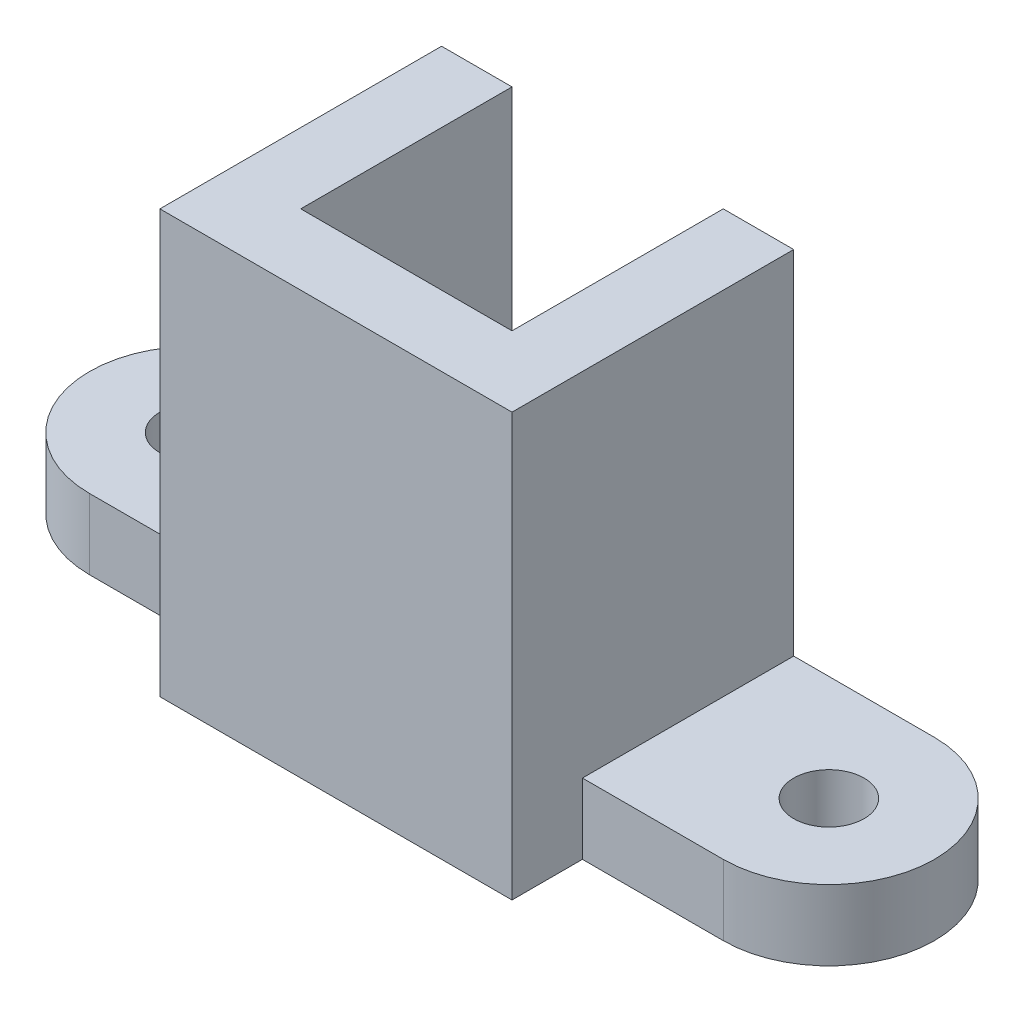
from build123d import *

# Parameters (mm, degrees)
SKETCH1_R           = 5
BOSS_EXTRUDE4_DEPTH = 10
BOSS_EXTRUDE6_DEPTH = 60
BOSS_EXTRUDE7_DEPTH = 30


with BuildPart() as part:
    # Sketch1 → Boss-Extrude4 (new body)
    with BuildSketch(Plane(origin=(0, 0, 0), x_dir=(1, 0, 0), z_dir=(0, 1, 0))):
        with BuildLine():
            Line((0, -15), (20, -15))
            Line((20, -15), (20, -25))
            Line((20, -25), (70, -25))
            Line((70, -25), (70, -15))
            Line((70, -15), (90, -15))
            ThreePointArc((90, -15), (105, 0), (90, 15))
            Line((90, 15), (0, 15))
            ThreePointArc((0, 15), (-15, 0), (0, -15))
        make_face()
        with Locations(Location((0, 0, 0), (0, 0, 270))):
            Circle(SKETCH1_R, mode=Mode.SUBTRACT)
        with Locations(Location((90, 0, 0), (0, 0, 270))):
            Circle(SKETCH1_R, mode=Mode.SUBTRACT)
    extrude(amount=BOSS_EXTRUDE4_DEPTH)

    # Sketch4 → Boss-Extrude6 (add)
    with BuildSketch(Plane.XZ):
        Polygon((20, -15), (30, -15), (30, 15), (60, 15), (60, -15), (70, -15), (70, 25), (20, 25), align=None)
    extrude(amount=-BOSS_EXTRUDE6_DEPTH)

    # Sketch5 → Boss-Extrude7 (add)
    with BuildSketch(Plane.ZY.offset(-60)):
        Polygon((-15, 10), (15, 60), (15, 10), align=None)
    extrude(amount=BOSS_EXTRUDE7_DEPTH)


solid = part.part
